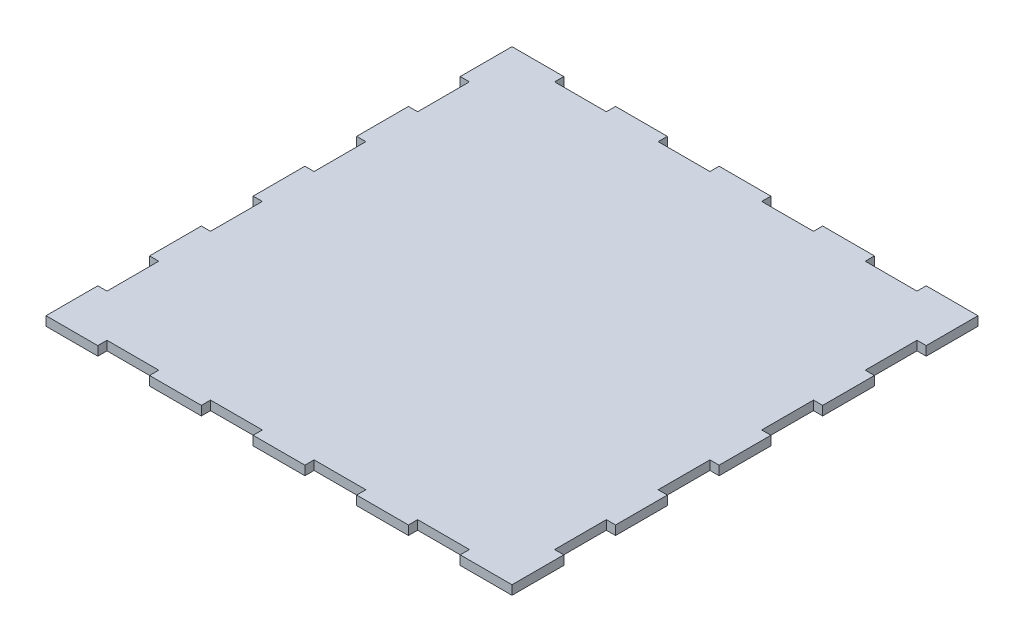
from build123d import *

# Parameters (mm, degrees)
BOSS_EXTRUDE1_DEPTH                      = 3
MIRROR1_AT_THE_SECOND_PLANE_COPY_1_DEPTH = 3


with BuildPart() as part:
    # Sketch1 → Boss-Extrude1 (new body)
    with BuildSketch(Plane(origin=(0, 0, 0), x_dir=(1, 0, 0), z_dir=(0, 1, 0))):
        Polygon((-76, -76), (-59.111111111, -76), (-59.111111111, -73), (-42.222222222, -73), (-42.222222222, -76), (-25.333333333, -76), (-25.333333333, -73), (-8.444444444, -73), (-8.444444444, -76), (0, -76), (0, 0), (-76, 0), (-76, -8.444444444), (-73, -8.444444444), (-73, -25.333333333), (-76, -25.333333333), (-76, -42.222222222), (-73, -42.222222222), (-73, -59.111111111), (-76, -59.111111111), align=None)
    boss_extrude1 = extrude(amount=BOSS_EXTRUDE1_DEPTH)



with BuildPart() as mirror1_1:
    # Mirror1: Boss-Extrude1 across plane
    add(boss_extrude1.mirror(Plane.XY))


with BuildPart() as part_1:
    add(part.part)

    add(mirror1_1.part)  # Mirror1 at the second plane merges Mirror1_1
    # Mirror1 at the second plane: Boss-Extrude1 across plane
    add(boss_extrude1.mirror(Plane(origin=(0, 0, 0), x_dir=(0, 0, 1), z_dir=(1, 0, 0))))

    # Mirror1 at the second plane copy 1 sketc → Mirror1 at the second plane copy 1 (add)
    with BuildSketch(Plane(origin=(0, 0, 0), x_dir=(-1, 0, 0), z_dir=(0, 1, 0))):
        Polygon((-76, -76), (-59.111111111, -76), (-59.111111111, -73), (-42.222222222, -73), (-42.222222222, -76), (-25.333333333, -76), (-25.333333333, -73), (-8.444444444, -73), (-8.444444444, -76), (0, -76), (0, 0), (-76, 0), (-76, -8.444444444), (-73, -8.444444444), (-73, -25.333333333), (-76, -25.333333333), (-76, -42.222222222), (-73, -42.222222222), (-73, -59.111111111), (-76, -59.111111111), align=None)
    extrude(amount=MIRROR1_AT_THE_SECOND_PLANE_COPY_1_DEPTH)


solid = part_1.part
